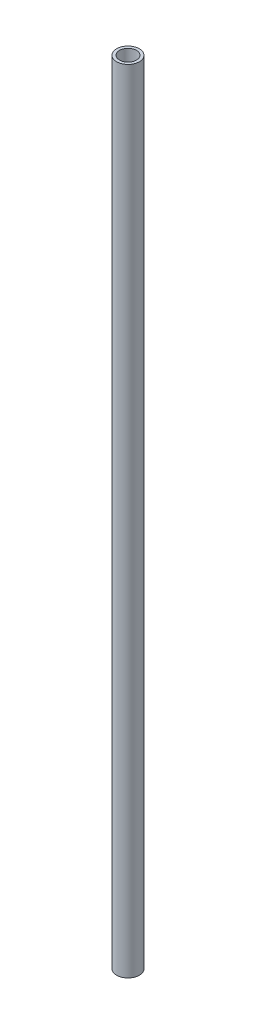
from build123d import *

# Parameters (mm, degrees)
SKETCH_1_R      = 4
SKETCH_1_R_2    = 3
EXTRUDE_1_DEPTH = 280


with BuildPart() as part:
    # 草图1 → 凸台-拉伸1 (new body)
    with BuildSketch(Plane(origin=(0, 0, 0), x_dir=(1, 0, 0), z_dir=(0, 1, 0))):
        with Locations(Location((0, 0, 0), (0, 0, 270))):
            Circle(SKETCH_1_R)
        with Locations(Location((0, 0, 0), (0, 0, 270))):
            Circle(SKETCH_1_R_2, mode=Mode.SUBTRACT)
    extrude(amount=EXTRUDE_1_DEPTH)


solid = part.part
